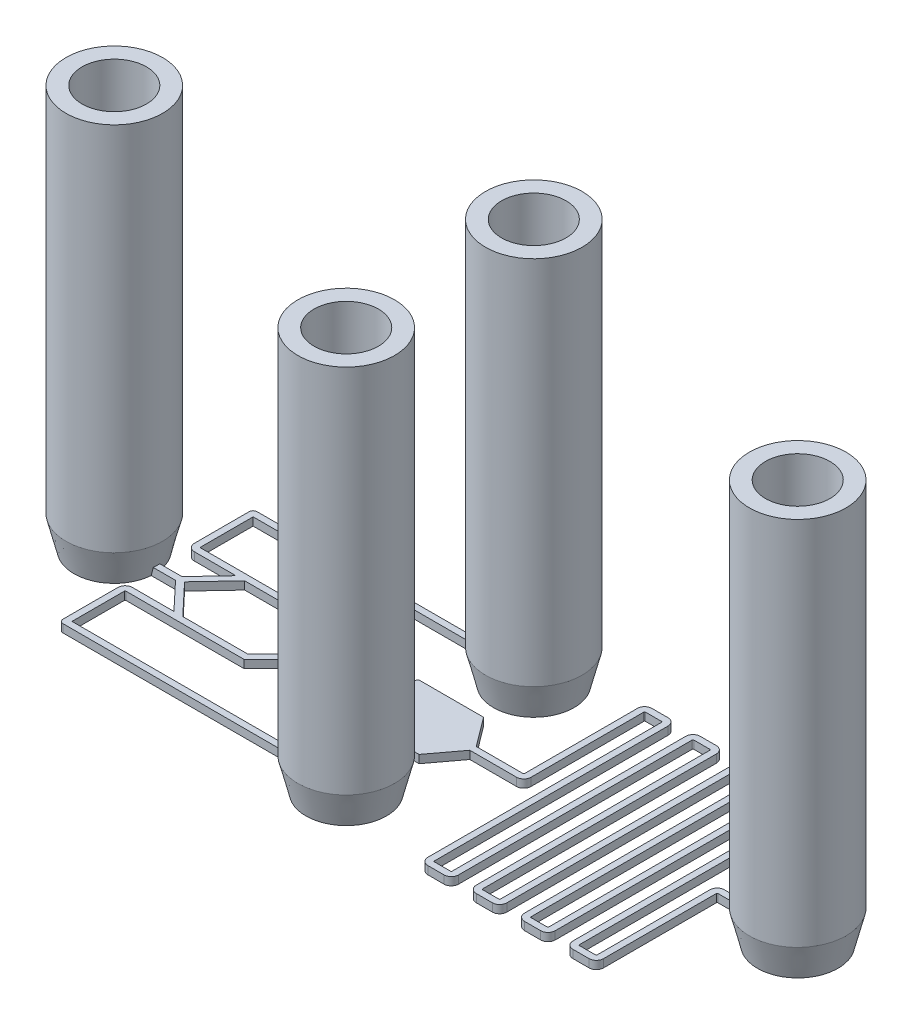
from build123d import *

# Parameters (mm, degrees)
SKELTON_EXTRU_DEPTH = 1
SKETCH8_R           = 4
CUT_EXTRUDE1_DEPTH  = 45


with BuildPart() as part:
    # Sketch2 → skelton_extru (new body)
    with BuildSketch(Plane(origin=(0, 0, 0), x_dir=(1, 0, 0), z_dir=(0, 1, 0))):
        with BuildLine():
            Line((-4, 4), (4, 4))
            Line((4, 4), (6.7, 0.4))
            Line((6.7, 0.4), (12.5, 0.4))
            ThreePointArc((12.5, 0.4), (12.570710678, 0.429289322), (12.6, 0.5))
            Line((12.6, 0.5), (12.6, 14.5))
            ThreePointArc((12.6, 14.5), (12.863603897, 15.136396103), (13.5, 15.4))
            Line((13.5, 15.4), (15.5, 15.4))
            ThreePointArc((15.5, 15.4), (16.136396103, 15.136396103), (16.4, 14.5))
            Line((16.4, 14.5), (16.4, 0))
            Line((16.4, 0), (16.4, -14.5))
            ThreePointArc((16.4, -14.5), (16.429289322, -14.570710678), (16.5, -14.6))
            Line((16.5, -14.6), (18.5, -14.6))
            ThreePointArc((18.5, -14.6), (18.570710678, -14.570710678), (18.6, -14.5))
            Line((18.6, -14.5), (18.6, 14.5))
            ThreePointArc((18.6, 14.5), (18.863603897, 15.136396103), (19.5, 15.4))
            Line((19.5, 15.4), (21.5, 15.4))
            ThreePointArc((21.5, 15.4), (22.136396103, 15.136396103), (22.4, 14.5))
            Line((22.4, 14.5), (22.4, -14.5))
            ThreePointArc((22.4, -14.5), (22.429289322, -14.570710678), (22.5, -14.6))
            Line((22.5, -14.6), (24.5, -14.6))
            ThreePointArc((24.5, -14.6), (24.570710678, -14.570710678), (24.6, -14.5))
            Line((24.6, -14.5), (24.6, 14.5))
            ThreePointArc((24.6, 14.5), (24.863603897, 15.136396103), (25.5, 15.4))
            Line((25.5, 15.4), (27.5, 15.4))
            ThreePointArc((27.5, 15.4), (28.136396103, 15.136396103), (28.4, 14.5))
            Line((28.4, 14.5), (28.4, -14.5))
            ThreePointArc((28.4, -14.5), (28.429289322, -14.570710678), (28.5, -14.6))
            Line((28.5, -14.6), (30.5, -14.6))
            ThreePointArc((30.5, -14.6), (30.570710678, -14.570710678), (30.6, -14.5))
            Line((30.6, -14.5), (30.6, 14.5))
            ThreePointArc((30.6, 14.5), (30.863603897, 15.136396103), (31.5, 15.4))
            Line((31.5, 15.4), (33.5, 15.4))
            ThreePointArc((33.5, 15.4), (34.136396103, 15.136396103), (34.4, 14.5))
            Line((34.4, 14.5), (34.4, -14.5))
            ThreePointArc((34.4, -14.5), (34.429289322, -14.570710678), (34.5, -14.6))
            Line((34.5, -14.6), (36.5, -14.6))
            ThreePointArc((36.5, -14.6), (36.570710678, -14.570710678), (36.6, -14.5))
            Line((36.6, -14.5), (36.6, -0.5))
            ThreePointArc((36.6, -0.5), (36.863603897, 0.136396103), (37.5, 0.4))
            Line((37.5, 0.4), (47, 0.4))
            ThreePointArc((47, 0.4), (47.4, 0), (47, -0.4))
            Line((47, -0.4), (37.5, -0.4))
            ThreePointArc((37.5, -0.4), (37.429289322, -0.429289322), (37.4, -0.5))
            Line((37.4, -0.5), (37.4, -14.5))
            ThreePointArc((37.4, -14.5), (37.136396103, -15.136396103), (36.5, -15.4))
            Line((36.5, -15.4), (34.5, -15.4))
            ThreePointArc((34.5, -15.4), (33.863603897, -15.136396103), (33.6, -14.5))
            Line((33.6, -14.5), (33.6, 14.5))
            ThreePointArc((33.6, 14.5), (33.570710678, 14.570710678), (33.5, 14.6))
            Line((33.5, 14.6), (31.5, 14.6))
            ThreePointArc((31.5, 14.6), (31.429289322, 14.570710678), (31.4, 14.5))
            Line((31.4, 14.5), (31.4, -14.5))
            ThreePointArc((31.4, -14.5), (31.136396103, -15.136396103), (30.5, -15.4))
            Line((30.5, -15.4), (28.5, -15.4))
            ThreePointArc((28.5, -15.4), (27.863603897, -15.136396103), (27.6, -14.5))
            Line((27.6, -14.5), (27.6, 14.5))
            ThreePointArc((27.6, 14.5), (27.570710678, 14.570710678), (27.5, 14.6))
            Line((27.5, 14.6), (25.5, 14.6))
            ThreePointArc((25.5, 14.6), (25.429289322, 14.570710678), (25.4, 14.5))
            Line((25.4, 14.5), (25.4, -14.5))
            ThreePointArc((25.4, -14.5), (25.136396103, -15.136396103), (24.5, -15.4))
            Line((24.5, -15.4), (22.5, -15.4))
            ThreePointArc((22.5, -15.4), (21.863603897, -15.136396103), (21.6, -14.5))
            Line((21.6, -14.5), (21.6, 14.5))
            ThreePointArc((21.6, 14.5), (21.570710678, 14.570710678), (21.5, 14.6))
            Line((21.5, 14.6), (19.5, 14.6))
            ThreePointArc((19.5, 14.6), (19.429289322, 14.570710678), (19.4, 14.5))
            Line((19.4, 14.5), (19.4, -14.5))
            ThreePointArc((19.4, -14.5), (19.136396103, -15.136396103), (18.5, -15.4))
            Line((18.5, -15.4), (16.5, -15.4))
            ThreePointArc((16.5, -15.4), (15.863603897, -15.136396103), (15.6, -14.5))
            Line((15.6, -14.5), (15.6, 0))
            Line((15.6, 0), (15.6, 14.5))
            ThreePointArc((15.6, 14.5), (15.570710678, 14.570710678), (15.5, 14.6))
            Line((15.5, 14.6), (13.5, 14.6))
            ThreePointArc((13.5, 14.6), (13.429289322, 14.570710678), (13.4, 14.5))
            Line((13.4, 14.5), (13.4, 0.5))
            ThreePointArc((13.4, 0.5), (13.136396103, -0.136396103), (12.5, -0.4))
            Line((12.5, -0.4), (6.7, -0.4))
            Line((6.7, -0.4), (4, -4))
            Line((4, -4), (-4, -4))
            Line((-4, -4), (-6.7, -0.4))
            Line((-6.7, -0.4), (-12.834314575, -0.4))
            Line((-12.834314575, -0.4), (-17.076955262, -4.642640687))
            Line((-17.076955262, -4.642640687), (-31.742640687, -4.642640687))
            ThreePointArc((-31.742640687, -4.642640687), (-31.813351365, -4.671930009), (-31.842640687, -4.742640687))
            Line((-31.842640687, -4.742640687), (-31.842640687, -11.242640687))
            Line((-31.842640687, -11.242640687), (2.6, -11.242640687))
            ThreePointArc((2.6, -11.242640687), (3, -11.642640687), (2.6, -12.042640687))
            Line((2.6, -12.042640687), (-31.842640687, -12.042640687))
            Line((-31.842640687, -12.042640687), (-32.142640687, -12.042640687))
            ThreePointArc((-32.142640687, -12.042640687), (-32.496194078, -11.896194078), (-32.642640687, -11.542640687))
            Line((-32.642640687, -11.542640687), (-32.642640687, -4.742640687))
            ThreePointArc((-32.642640687, -4.742640687), (-32.37903679, -4.106244584), (-31.742640687, -3.842640687))
            Line((-31.742640687, -3.842640687), (-26.585761453, -3.842640687))
            Line((-26.585761453, -3.842640687), (-29.831514219, -0.4))
            Line((-29.831514219, -0.4), (-37.831514219, -0.4))
            ThreePointArc((-37.831514219, -0.4), (-38.231514219, 0), (-37.831514219, 0.4))
            Line((-37.831514219, 0.4), (-29.831514219, 0.4))
            Line((-29.831514219, 0.4), (-26.585761453, 3.842640687))
            Line((-26.585761453, 3.842640687), (-31.742640687, 3.842640687))
            ThreePointArc((-31.742640687, 3.842640687), (-32.37903679, 4.106244584), (-32.642640687, 4.742640687))
            Line((-32.642640687, 4.742640687), (-32.642640687, 11.542640687))
            ThreePointArc((-32.642640687, 11.542640687), (-32.496194078, 11.896194078), (-32.142640687, 12.042640687))
            Line((-32.142640687, 12.042640687), (-31.842640687, 12.042640687))
            Line((-31.842640687, 12.042640687), (2.6, 12.042640687))
            ThreePointArc((2.6, 12.042640687), (3, 11.642640687), (2.6, 11.242640687))
            Line((2.6, 11.242640687), (-31.842640687, 11.242640687))
            Line((-31.842640687, 11.242640687), (-31.842640687, 4.742640687))
            ThreePointArc((-31.842640687, 4.742640687), (-31.813351365, 4.671930009), (-31.742640687, 4.642640687))
            Line((-31.742640687, 4.642640687), (-17.076955262, 4.642640687))
            Line((-17.076955262, 4.642640687), (-12.834314575, 0.4))
            Line((-12.834314575, 0.4), (-6.7, 0.4))
            Line((-6.7, 0.4), (-4, 4))
        make_face()
        Polygon((-13.565685425, 0), (-17.408326112, -3.842640687), (-25.486266619, -3.842640687), (-29.109143003, 0), (-25.486266619, 3.842640687), (-17.408326112, 3.842640687), align=None, mode=Mode.SUBTRACT)
    extrude(amount=SKELTON_EXTRU_DEPTH)

    # Sketch3 → Revolve1 (revolve)
    with BuildSketch(Plane.XY.offset(-11.642640687), mode=Mode.PRIVATE) as revolve1_sk:
        Polygon((2.6, 0), (7.6, 0), (8.6, 4), (8.6, 50), (2.6, 50), align=None)
    revolve(revolve1_sk.sketch.rotate(Axis((2.6, 0, -11.642640687), (0, 1, 0)), 184.588565502), axis=Axis((2.6, 0, -11.642640687), (0, 1, 0)))

    # Sketch4 → Revolve2 (revolve)
    with BuildSketch(Plane(origin=(0, 0, 0), x_dir=(-1, 0, 0), z_dir=(0, 0, -1)), mode=Mode.PRIVATE) as revolve2_sk:
        Polygon((-47, 0), (-52, 0), (-53, 4), (-53, 50), (-47, 50), align=None)
    revolve(revolve2_sk.sketch.rotate(Axis((47, 0, 0), (0, 1, 0)), 184.588558424), axis=Axis((47, 0, 0), (0, 1, 0)))

    # Sketch5 → Revolve3 (revolve)
    with BuildSketch(Plane(origin=(0, 0, 0), x_dir=(-1, 0, 0), z_dir=(0, 0, -1))):
        Polygon((37.831514219, 50), (37.831514219, 0), (42.831514219, 0), (43.831514219, 4), (43.831514219, 50), align=None)
    revolve(axis=Axis((-37.831514219, 50, 0), (0, -1, 0)))

    # Sketch6 → Revolve4 (revolve)
    with BuildSketch(Plane.XY.offset(11.642640687), mode=Mode.PRIVATE) as revolve4_sk:
        Polygon((2.6, 0), (7.6, 0), (8.6, 4), (8.6, 50), (2.6, 50), align=None)
    revolve(revolve4_sk.sketch.rotate(Axis((2.6, 0, 11.642640687), (0, 1, 0)), 184.588565502), axis=Axis((2.6, 0, 11.642640687), (0, 1, 0)))

    # Sketch8 → Cut-Extrude1 (cut)
    with BuildSketch(Plane(origin=(0, 50, 0), x_dir=(1, 0, 0), z_dir=(0, 1, 0))):
        with Locations(Location((-37.831514219, 0, 0), (0, 0, 180))):
            Circle(SKETCH8_R)
        with Locations(Location((2.6, 11.642640687, 0), (0, 0, 180))):
            Circle(SKETCH8_R)
        with Locations(Location((2.6, -11.642640687, 0), (0, 0, 180))):
            Circle(SKETCH8_R)
        with Locations(Location((47, 0, 0), (0, 0, 180))):
            Circle(SKETCH8_R)
    extrude(amount=-CUT_EXTRUDE1_DEPTH, mode=Mode.SUBTRACT)


solid = part.part
